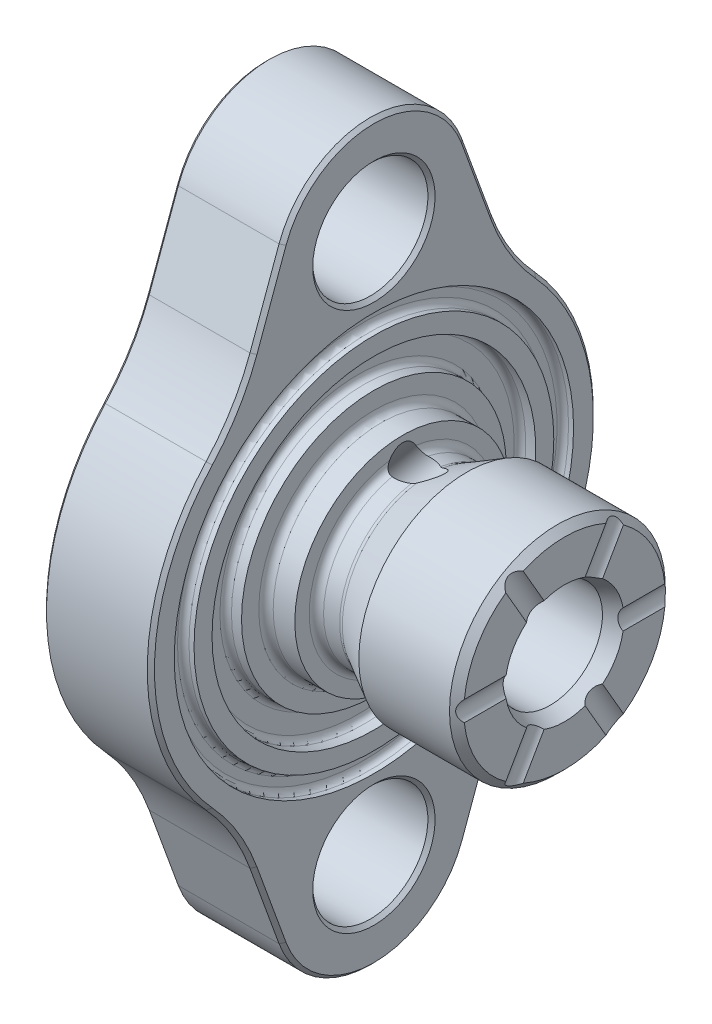
from build123d import *

# Parameters (mm, degrees)
SKETCH2_OUTSIDE_W  = 137.836
SKETCH2_OUTSIDE_H  = 137.836
CUT_EXTRUDE1_DEPTH = 86.057333605
SKETCH3_R          = 8
CUT_EXTRUDE2_DEPTH = 73.692846966
CHAMFER2_SIZE      = 1
CUT_EXTRUDE4_DEPTH = 73.692846966
CIRPATTERN1_COUNT  = 6
CIRPATTERN2_COUNT  = 2
SKETCH13_W         = 0.307692308
SKETCH13_H         = 1.153846154
SKETCH13_W_2       = 0.307692307
EXTRUDE1_DEPTH     = 0.1
CHAMFER3_SIZE      = 0.5


with BuildPart() as part:
    # Sketch1 → Revolve1 (revolve)
    with BuildSketch(Plane.XY, mode=Mode.PRIVATE) as revolve1_sk:
        with BuildLine():
            Line((0, 0), (0, 52.5))
            Line((0, 52.5), (15, 52.5))
            Line((15, 52.5), (15, 27.75))
            Line((15, 27.75), (14.3, 27.75))
            ThreePointArc((14.3, 27.75), (13.734314575, 27.515685425), (13.5, 26.95))
            Line((13.5, 26.95), (13.5, 25.8))
            ThreePointArc((13.5, 25.8), (13.734314575, 25.234314575), (14.3, 25))
            Line((14.3, 25), (15, 25))
            Line((15, 25), (15, 22.5))
            Line((15, 22.5), (13.6, 22.5))
            ThreePointArc((13.6, 22.5), (13.034314575, 22.265685425), (12.8, 21.7))
            Line((12.8, 21.7), (12.8, 19.2))
            ThreePointArc((12.8, 19.2), (13.034314575, 18.634314575), (13.6, 18.4))
            Line((13.6, 18.4), (15, 18.4))
            Line((15, 18.4), (15, 15.9975))
            ThreePointArc((15, 15.9975), (15.292893219, 15.290393219), (16, 14.9975))
            Line((16, 14.9975), (19, 14.9975))
            Line((19, 14.9975), (19, 13))
            ThreePointArc((19, 13), (19.292893219, 12.292893219), (20, 12))
            Line((20, 12), (22.241062764, 12))
            ThreePointArc((22.241062764, 12), (22.491732804, 12.031927414), (22.726396351, 12.125670937))
            Line((22.726396351, 12.125670937), (27.9, 14.9975))
            Line((27.9, 14.9975), (41.5, 14.9975))
            Line((41.5, 14.9975), (41.5, 8.25))
            Line((41.5, 8.25), (39.5, 7.265))
            Line((39.5, 7.265), (30, 7.265))
            Line((30, 7.265), (30, 7.5))
            Line((30, 7.5), (28.5, 7.5))
            Line((28.5, 7.5), (27.90815229, 6.515))
            Line((27.90815229, 6.515), (19, 6.515))
            Line((19, 6.515), (19, 6.9))
            Line((19, 6.9), (12.5, 6.9))
            Line((12.5, 6.9), (8.516283143, 0))
            Line((8.516283143, 0), (0, 0))
        make_face()
    revolve(revolve1_sk.sketch.rotate(Axis((0, 0, 0), (1, 0, 0)), 90), axis=Axis((0, 0, 0), (1, 0, 0)))

    # Sketch2 outside → Cut-Extrude1 (cut, through all)
    with BuildSketch(Plane.ZY):
        Rectangle(SKETCH2_OUTSIDE_W, SKETCH2_OUTSIDE_H)
        with BuildLine():
            Line((12.685850381, 42.117271935), (16.72864246, 31.009791985))
            ThreePointArc((16.72864246, 31.009791985), (19.282353353, 25.690256421), (22.827902518, 20.973480079))
            ThreePointArc((22.827902518, 20.973480079), (31, 0), (22.827902518, -20.973480079))
            ThreePointArc((22.827902518, -20.973480079), (19.282353353, -25.690256421), (16.72864246, -31.009791985))
            Line((16.72864246, -31.009791985), (12.685850381, -42.117271935))
            ThreePointArc((12.685850381, -42.117271935), (0, -51), (-12.685850381, -42.117271935))
            Line((-12.685850381, -42.117271935), (-16.72864246, -31.009791985))
            ThreePointArc((-16.72864246, -31.009791985), (-19.282353353, -25.690256421), (-22.827902518, -20.973480079))
            ThreePointArc((-22.827902518, -20.973480079), (-31, 0), (-22.827902518, 20.973480079))
            ThreePointArc((-22.827902518, 20.973480079), (-19.282353353, 25.690256421), (-16.72864246, 31.009791985))
            Line((-16.72864246, 31.009791985), (-12.685850381, 42.117271935))
            ThreePointArc((-12.685850381, 42.117271935), (0, 51), (12.685850381, 42.117271935))
        make_face(mode=Mode.SUBTRACT)
    extrude(amount=-CUT_EXTRUDE1_DEPTH, mode=Mode.SUBTRACT)

    # Sketch3 → Cut-Extrude2 (cut, through all)
    with BuildSketch(Plane.ZY):
        with Locations((0, 37.5)):
            Circle(SKETCH3_R)
    cut_extrude2 = extrude(amount=-CUT_EXTRUDE2_DEPTH, mode=Mode.SUBTRACT)

    # Mirror1: Cut-Extrude2 across plane
    add(cut_extrude2.mirror(Plane.ZX), mode=Mode.SUBTRACT)

    # Chamfer2
    chamfer2_edges = [part.edges().sort_by_distance(p)[0] for p in [
        (41.5, 0, -14.9975),
    ]]
    chamfer(chamfer2_edges, length=CHAMFER2_SIZE)

    # Sketch8 → Cut-Extrude4 (cut, through all)
    with BuildSketch(Plane.XY):
        with BuildLine():
            Line((45.418346774, -1.4), (41.5, -1.4))
            ThreePointArc((41.5, -1.4), (40.928285686, 0), (41.5, 1.4))
            Line((41.5, 1.4), (45.418346774, 1.4))
            Line((45.418346774, 1.4), (45.418346774, -1.4))
        make_face()
    cut_extrude4 = extrude(amount=-CUT_EXTRUDE4_DEPTH, mode=Mode.SUBTRACT)

    # CirPattern1: Cut-Extrude4 ×6 about axis
    cirpattern1_axis = Axis((30, 0, 0), (1, 0, 0))
    for i in range(1, CIRPATTERN1_COUNT):
        add(cut_extrude4.rotate(cirpattern1_axis, i * 360 / CIRPATTERN1_COUNT), mode=Mode.SUBTRACT)

    # Sketch14 → Cut-Revolve1 (revolve, cut)
    with BuildSketch(Plane.XY, mode=Mode.PRIVATE) as cut_revolve1_sk:
        Polygon((25.804414216, 14.432245132), (15.582644358, 2.25041418), (12.319126134, 2.25041418), (23.889303109, 16.039214156), align=None)
    cut_revolve1 = revolve(cut_revolve1_sk.sketch.rotate(Axis((23.889303109, 16.039214156, 0), (-0.6427876096865435, -0.7660444431189747, 0)), 133.130301737), axis=Axis((23.889303109, 16.039214156, 0), (-0.6427876096865435, -0.7660444431189747, 0)), mode=Mode.SUBTRACT)

    # CirPattern2: Cut-Revolve1 ×2 about axis
    cirpattern2_axis = Axis((30, 0, 0), (1, 0, 0))
    for i in range(1, CIRPATTERN2_COUNT):
        add(cut_revolve1.rotate(cirpattern2_axis, i * 360 / CIRPATTERN2_COUNT), mode=Mode.SUBTRACT)

    # Sketch13 → Extrude1 (cut)
    # profile 1 of 21: a face of its own
    with BuildSketch(Plane.ZY):
        with BuildLine():
            Line((10.307692308, 15.000112869), (10.307692308, 15.269343639))
            add(Edge.make_bspline(
                [(10.307692308, 15.269343639), (10.33789158, 15.262049738), (10.396928686, 15.247790759), (10.481277767, 15.218049982), (10.561097928, 15.18565062), (10.634894563, 15.146745673), (10.704150765, 15.104309598), (10.767295729, 15.055690123), (10.825935414, 15.003130361), (10.877975332, 14.94499469), (10.925099099, 14.884027265), (10.96527772, 14.81936902), (10.99984128, 14.752320825), (11.028315764, 14.68241814), (11.049766213, 14.60945285), (11.065329189, 14.534084601), (11.075435859, 14.456115887), (11.076422227, 14.403189381), (11.076923077, 14.376314793)],
                knots=[0, 0, 0, 0, 1.162005537, 2.271625781, 3.343758855, 4.383309926, 5.390229558, 6.379919256, 7.361854164, 8.333198761, 9.295911338, 10.242430842, 11.177959212, 12.116337295, 13.062827104, 14.020064771, 14.994644689, 16, 16, 16, 16], degree=3))
            add(Edge.make_bspline(
                [(11.076923077, 14.376314793), (11.07574088, 14.337158156), (11.073402272, 14.259699004), (11.052047041, 14.145902107), (11.01825407, 14.036164833), (10.971562304, 13.931688335), (10.913973178, 13.834643964), (10.845431975, 13.748298661), (10.767261146, 13.673822795), (10.680918948, 13.6113419), (10.588642797, 13.562420472), (10.493671233, 13.526346438), (10.396229544, 13.504384997), (10.33043759, 13.501538805), (10.297475962, 13.500112869)],
                knots=[0, 0, 0, 0, 1.083050992, 2.142477498, 3.193116406, 4.255571735, 5.30263384, 6.308962982, 7.297363603, 8.282367274, 9.249857812, 10.179914175, 11.08814088, 12, 12, 12, 12], degree=3))
            add(Edge.make_bspline(
                [(10.297475962, 13.500112869), (10.265755852, 13.501110233), (10.203684519, 13.503061919), (10.113066093, 13.519633667), (10.027659007, 13.547521892), (9.947103725, 13.586153117), (9.871911006, 13.63616016), (9.801911671, 13.696736758), (9.736795249, 13.768310468), (9.699492844, 13.822549558), (9.680288462, 13.850473446)],
                knots=[0, 0, 0, 0, 1.024540389, 2.004866551, 2.965041327, 3.920577974, 4.882998113, 5.874504559, 6.905732034, 8, 8, 8, 8], degree=3))
            add(Edge.make_bspline(
                [(9.680288462, 13.850473446), (9.6648786, 13.818560514), (9.634347208, 13.755331765), (9.574470844, 13.669145596), (9.505336832, 13.590907417), (9.451385987, 13.547275658), (9.424278846, 13.525353254)],
                knots=[0, 0, 0, 0, 1.015518401, 2.012035669, 3.001164323, 4, 4, 4, 4], degree=3))
            add(Edge.make_bspline(
                [(9.424278846, 13.525353254), (9.404517165, 13.510911942), (9.365317415, 13.482265803), (9.302255422, 13.447006906), (9.238703223, 13.414654491), (9.172162029, 13.39084405), (9.10476926, 13.370296584), (9.035081767, 13.356777035), (8.963761641, 13.348098025), (8.915490179, 13.346879315), (8.891225962, 13.346266716)],
                knots=[0, 0, 0, 0, 1.02516404, 2.033540309, 3.025129118, 4.011046665, 4.991655828, 5.976607087, 6.982917762, 8, 8, 8, 8], degree=3))
            add(Edge.make_bspline(
                [(8.891225962, 13.346266716), (8.8492193, 13.347808257), (8.76540366, 13.350884085), (8.641543127, 13.378265345), (8.520676779, 13.420958553), (8.404595461, 13.480526441), (8.296212681, 13.554227566), (8.199679513, 13.642395857), (8.1161433, 13.742887957), (8.046571888, 13.855046166), (7.99091776, 13.976507324), (7.952299868, 14.106432162), (7.927145399, 14.242931418), (7.924448187, 14.336537782), (7.923076923, 14.384127293)],
                knots=[0, 0, 0, 0, 0.95570045, 1.906903359, 2.87519758, 3.868912786, 4.869932978, 5.851730567, 6.836639976, 7.83677598, 8.849487602, 9.869908895, 10.917060885, 12, 12, 12, 12], degree=3))
            add(Edge.make_bspline(
                [(7.923076923, 14.384127293), (7.923821106, 14.416200978), (7.925285409, 14.479311297), (7.935295639, 14.572091439), (7.953578501, 14.660652895), (7.978181334, 14.745115408), (8.009374256, 14.82555401), (8.048218854, 14.901723243), (8.093914427, 14.974091723), (8.14700036, 15.041976539), (8.206384365, 15.105369597), (8.273120659, 15.162586217), (8.345975577, 15.214580326), (8.425795339, 15.25995973), (8.511548417, 15.300791404), (8.604332844, 15.334375081), (8.703319149, 15.36393414), (8.772300069, 15.377677109), (8.807692308, 15.384728254)],
                knots=[0, 0, 0, 0, 1.048658725, 2.063410685, 3.046034179, 4.001477787, 4.936774919, 5.862367409, 6.792675028, 7.730719943, 8.675894397, 9.627829632, 10.600096036, 11.597688215, 12.626045268, 13.701542398, 14.82072376, 16, 16, 16, 16], degree=3))
            Line((8.807692308, 15.384728254), (8.807692308, 15.115497485))
            add(Edge.make_bspline(
                [(8.807692308, 15.115497485), (8.784593153, 15.108483235), (8.739663292, 15.09483991), (8.675000173, 15.071616226), (8.615721842, 15.045157707), (8.561393451, 15.0167738), (8.511479963, 14.986963703), (8.467301219, 14.953608053), (8.42691676, 14.919177357), (8.404164235, 14.893223626), (8.393028846, 14.880521523)],
                knots=[0, 0, 0, 0, 1.198163088, 2.33053128, 3.407730985, 4.417276592, 5.372219308, 6.28897303, 7.162600585, 8, 8, 8, 8], degree=3))
            add(Edge.make_bspline(
                [(8.393028846, 14.880521523), (8.380078846, 14.863724458), (8.354218818, 14.830182175), (8.321217423, 14.775523691), (8.292622258, 14.718039503), (8.27077909, 14.656484068), (8.252283952, 14.592185694), (8.24018065, 14.524105095), (8.231876503, 14.452842909), (8.231143705, 14.404184826), (8.230769231, 14.3793196)],
                knots=[0, 0, 0, 0, 0.946170439, 1.889420265, 2.845303464, 3.807233317, 4.801018734, 5.828864929, 6.890507805, 8, 8, 8, 8], degree=3))
            add(Edge.make_bspline(
                [(8.230769231, 14.3793196), (8.231296291, 14.351244789), (8.232326912, 14.29634692), (8.24183237, 14.216248065), (8.25561558, 14.14002271), (8.277175201, 14.068448737), (8.303039527, 14.000552199), (8.336900678, 13.937848742), (8.375141373, 13.878494963), (8.419622657, 13.824229653), (8.467702109, 13.775306823), (8.518710124, 13.733032092), (8.57106512, 13.69641734), (8.625988434, 13.666985191), (8.682941311, 13.643702978), (8.742136929, 13.627862988), (8.803076821, 13.616846671), (8.844501736, 13.615949674), (8.865384615, 13.615497485)],
                knots=[0, 0, 0, 0, 1.216990249, 2.379719373, 3.493992396, 4.571561497, 5.616923107, 6.638958652, 7.655775068, 8.674704564, 9.676001865, 10.625896028, 11.54399481, 12.441854662, 13.322657739, 14.20572845, 15.095482574, 16, 16, 16, 16], degree=3))
            add(Edge.make_bspline(
                [(8.865384615, 13.615497485), (8.893337223, 13.616809149), (8.94910335, 13.619425949), (9.031146512, 13.639405081), (9.110196997, 13.672265604), (9.184894729, 13.718275944), (9.254158865, 13.774257612), (9.315717703, 13.839668706), (9.367023445, 13.914669681), (9.402340393, 13.984143404), (9.425877654, 14.045829407), (9.442381541, 14.098514155), (9.455574456, 14.157548512), (9.468335977, 14.222223782), (9.479034427, 14.292812735), (9.487994798, 14.369378965), (9.49515324, 14.451953276), (9.498351754, 14.509117018), (9.5, 14.538574408)],
                knots=[0, 0, 0, 0, 1.070481957, 2.135637345, 3.216366529, 4.339485895, 5.485746587, 6.620975969, 7.768829582, 8.956804399, 9.598399438, 10.297751078, 11.070570279, 11.915248466, 12.824061284, 13.805856426, 14.869322739, 16, 16, 16, 16], degree=3))
            Line((9.5, 14.538574408), (9.807692308, 14.538574408))
            add(Edge.make_bspline(
                [(9.807692308, 14.538574408), (9.808324886, 14.501460149), (9.80956395, 14.428762433), (9.824446445, 14.322552874), (9.845265096, 14.220869774), (9.87641744, 14.126034166), (9.913809143, 14.03987673), (9.955971019, 13.964717859), (10.003738533, 13.90233879), (10.056484782, 13.852583673), (10.113716361, 13.816065184), (10.172742216, 13.788654442), (10.234935682, 13.772585153), (10.277355669, 13.770427948), (10.298677885, 13.769343639)],
                knots=[0, 0, 0, 0, 1.321708579, 2.588902423, 3.815526512, 5.016621128, 6.138757764, 7.158873101, 8.079948563, 8.928590313, 9.728601868, 10.489025425, 11.240515403, 12, 12, 12, 12], degree=3))
            add(Edge.make_bspline(
                [(10.298677885, 13.769343639), (10.314344561, 13.769698807), (10.345512671, 13.770405397), (10.391047891, 13.779317956), (10.435193622, 13.792707726), (10.477749556, 13.8111276), (10.518468679, 13.83573734), (10.557400946, 13.865277227), (10.59519882, 13.899761518), (10.630054006, 13.940091459), (10.662931371, 13.983752921), (10.69135263, 14.031156731), (10.715442471, 14.081257341), (10.735345814, 14.134100821), (10.750308307, 14.189898861), (10.761054045, 14.248378243), (10.767771832, 14.309653547), (10.768739073, 14.351457868), (10.769230769, 14.372709023)],
                knots=[0, 0, 0, 0, 0.884317272, 1.759307272, 2.611736065, 3.488921043, 4.37244062, 5.294096728, 6.247679003, 7.258495569, 8.302441962, 9.333537773, 10.376747089, 11.440883505, 12.520330301, 13.637364711, 14.798958396, 16, 16, 16, 16], degree=3))
            add(Edge.make_bspline(
                [(10.769230769, 14.372709023), (10.768040487, 14.406868725), (10.765715588, 14.473590566), (10.745280774, 14.569759054), (10.712903918, 14.659068392), (10.673808961, 14.727104092), (10.635349996, 14.777429301), (10.602263749, 14.814080705), (10.564750721, 14.849416413), (10.521781972, 14.88204982), (10.474835025, 14.913936388), (10.423651312, 14.944771648), (10.367501106, 14.973565172), (10.328014664, 14.991092261), (10.307692308, 15.000112869)],
                knots=[0, 0, 0, 0, 1.4727372, 2.876598283, 4.222346151, 5.558423782, 6.24313385, 6.953189256, 7.68715613, 8.463578749, 9.278833271, 10.135787152, 11.040551781, 12, 12, 12, 12], degree=3))
        make_face()
    # profile 2 of 21: a face of its own
    with BuildSketch(Plane.ZY):
        Polygon((11, 12.439415754), (11, 11.884728254), (8, 11.884728254), (8, 12.153959023), (10.692307692, 12.153959023), (10.692307692, 12.615497485), align=None)
    # profile 3 of 21: a face of its own
    with BuildSketch(Plane.ZY):
        Polygon((11, 10.131723446), (11, 9.577035946), (8, 9.577035946), (8, 9.846266716), (10.692307692, 9.846266716), (10.692307692, 10.307805177), align=None)
    # profile 4 of 21: a face of its own
    with BuildSketch(Plane.ZY):
        with BuildLine():
            Line((11, 6.577035946), (10.692307692, 6.577035946))
            Line((10.692307692, 6.577035946), (10.692307692, 7.596867677))
            Line((10.692307692, 7.596867677), (9.903245192, 7.759127293))
            add(Edge.make_bspline(
                [(9.903245192, 7.759127293), (9.912013997, 7.727365114), (9.929002168, 7.665830918), (9.947864257, 7.57500818), (9.959234638, 7.488786291), (9.96078719, 7.432835974), (9.961538462, 7.405761908)],
                knots=[0, 0, 0, 0, 1.100273476, 2.13160584, 3.095893838, 4, 4, 4, 4], degree=3))
            add(Edge.make_bspline(
                [(9.961538462, 7.405761908), (9.960813184, 7.372261675), (9.959387107, 7.306391848), (9.945699647, 7.210013965), (9.924141356, 7.118020308), (9.894073597, 7.030568052), (9.855376794, 6.947468834), (9.807664445, 6.869186719), (9.751266572, 6.795278054), (9.686727319, 6.726719881), (9.61560935, 6.664620376), (9.539393104, 6.609804949), (9.458009254, 6.564216204), (9.371817674, 6.52670966), (9.280962984, 6.496951838), (9.184772679, 6.477091336), (9.084100359, 6.463881421), (9.015268218, 6.462404477), (8.980168269, 6.461651331)],
                knots=[0, 0, 0, 0, 1.052772836, 2.070014431, 3.053871312, 4.019926262, 4.972333346, 5.930471369, 6.896690565, 7.89035727, 8.885779078, 9.861050232, 10.836829716, 11.812751485, 12.812646763, 13.836748493, 14.896881366, 16, 16, 16, 16], degree=3))
            add(Edge.make_bspline(
                [(8.980168269, 6.461651331), (8.95572062, 6.462221319), (8.90715571, 6.463353591), (8.835032579, 6.469113506), (8.764434116, 6.480197075), (8.695361378, 6.49509915), (8.627906708, 6.514364289), (8.562094644, 6.537939406), (8.497722538, 6.565728657), (8.434786175, 6.59710338), (8.375225782, 6.63339812), (8.318121955, 6.671630393), (8.265576235, 6.713981228), (8.215670353, 6.758400207), (8.170364191, 6.806663464), (8.127718904, 6.857272984), (8.089586913, 6.911416445), (8.054514091, 6.968124479), (8.023111247, 7.027361327), (7.996915667, 7.089727637), (7.973955014, 7.153854306), (7.95528329, 7.220312888), (7.94079673, 7.288974634), (7.93093158, 7.360075984), (7.923753825, 7.433260165), (7.923304096, 7.482867216), (7.923076923, 7.507925369)],
                knots=[0, 0, 0, 0, 1.05623316, 2.098192244, 3.122504159, 4.140841222, 5.148757784, 6.150489607, 7.158294732, 8.176043417, 9.185147859, 10.169157858, 11.142149047, 12.097904048, 13.0527185, 13.998867679, 14.954465986, 15.910220987, 16.877849176, 17.847023716, 18.829548819, 19.818454515, 20.826519638, 21.858115382, 22.918063636, 24, 24, 24, 24], degree=3))
            add(Edge.make_bspline(
                [(7.923076923, 7.507925369), (7.923669122, 7.537817488), (7.924834203, 7.596626699), (7.937020736, 7.682787707), (7.954478222, 7.765684035), (7.980728043, 7.844659634), (8.013667747, 7.92038082), (8.055034258, 7.991839602), (8.102566261, 8.060440533), (8.157903772, 8.124319121), (8.218955449, 8.183485862), (8.28449812, 8.23726329), (8.354792393, 8.284425772), (8.429239827, 8.325165775), (8.507968523, 8.359866215), (8.591214063, 8.387139556), (8.678557676, 8.409148656), (8.738689153, 8.418460286), (8.769230769, 8.423189793)],
                knots=[0, 0, 0, 0, 1.046825758, 2.059506013, 3.044032586, 4.011925612, 4.970610144, 5.93275819, 6.900651216, 7.891265644, 8.889116719, 9.876966323, 10.858259055, 11.851035124, 12.847502422, 13.86866322, 14.9174643, 16, 16, 16, 16], degree=3))
            Line((8.769230769, 8.423189793), (8.769230769, 8.153959023))
            add(Edge.make_bspline(
                [(8.769230769, 8.153959023), (8.740619652, 8.147338715), (8.685627496, 8.134614114), (8.608408384, 8.106610848), (8.53933665, 8.072582767), (8.478347086, 8.031199182), (8.424883236, 7.982831814), (8.376827964, 7.928035742), (8.334048616, 7.866030324), (8.298160408, 7.797155086), (8.267598198, 7.724449041), (8.247236672, 7.648365289), (8.232922387, 7.570960929), (8.231489347, 7.518608125), (8.230769231, 7.492300369)],
                knots=[0, 0, 0, 0, 1.136389429, 2.184203582, 3.172920998, 4.111012962, 5.028380909, 5.957351669, 6.927793475, 7.937618031, 8.960409703, 9.974842029, 10.982339866, 12, 12, 12, 12], degree=3))
            add(Edge.make_bspline(
                [(8.230769231, 7.492300369), (8.231472755, 7.466621703), (8.232857999, 7.416060198), (8.243520009, 7.341650438), (8.259940785, 7.269810832), (8.284514946, 7.20125024), (8.314381848, 7.13476892), (8.352709056, 7.072048546), (8.396817643, 7.011274651), (8.447351897, 6.954336251), (8.503040207, 6.902188152), (8.562592258, 6.856111476), (8.626120984, 6.817731265), (8.692526544, 6.785387743), (8.762536735, 6.760827772), (8.835823457, 6.743306931), (8.912567726, 6.733018595), (8.964912848, 6.731603298), (8.991586538, 6.7308821)],
                knots=[0, 0, 0, 0, 1.027316725, 2.022795036, 3.002884548, 3.971462791, 4.93288096, 5.914575861, 6.907176829, 7.935150275, 8.956128384, 9.956726525, 10.942570165, 11.921478529, 12.907843606, 13.90538589, 14.932640048, 16, 16, 16, 16], degree=3))
            add(Edge.make_bspline(
                [(8.991586538, 6.7308821), (9.015665969, 6.731355603), (9.062825038, 6.732282948), (9.131515754, 6.742588032), (9.196982005, 6.757023856), (9.25863835, 6.779188221), (9.317387656, 6.806574176), (9.371972473, 6.841318535), (9.42379518, 6.881034915), (9.470750501, 6.927553782), (9.514380581, 6.978280629), (9.551519507, 7.034392998), (9.582777841, 7.094611008), (9.609749431, 7.158237701), (9.629121772, 7.226778674), (9.643665597, 7.298878748), (9.652078786, 7.375315897), (9.653246116, 7.427576491), (9.653846154, 7.454439793)],
                knots=[0, 0, 0, 0, 1.045726679, 2.048034203, 3.01323695, 3.95502507, 4.889743367, 5.8246644, 6.761650845, 7.722168973, 8.692072792, 9.66525385, 10.638902184, 11.638179751, 12.663148338, 13.728659964, 14.832472288, 16, 16, 16, 16], degree=3))
            add(Edge.make_bspline(
                [(9.653846154, 7.454439793), (9.653365403, 7.477895098), (9.652381232, 7.525911749), (9.644636009, 7.599737269), (9.632720729, 7.676979212), (9.615547008, 7.757937456), (9.594044327, 7.842389826), (9.567190174, 7.930476766), (9.536257576, 8.022200406), (9.512265199, 8.083936983), (9.5, 8.115497485)],
                knots=[0, 0, 0, 0, 0.824638674, 1.688163388, 2.607705698, 3.571998603, 4.597075385, 5.671199175, 6.809488238, 8, 8, 8, 8], degree=3))
            Line((9.5, 8.115497485), (11, 7.807805177))
            Line((11, 7.807805177), (11, 6.577035946))
        make_face()
    # profile 5 of 21: a face of its own
    with BuildSketch(Plane.ZY):
        with BuildLine():
            Line((10.076923077, 4.615497485), (10.076923077, 4.884728254))
            add(Edge.make_bspline(
                [(10.076923077, 4.884728254), (10.112641157, 4.88297385), (10.182790515, 4.879528248), (10.285065658, 4.863385488), (10.382835931, 4.840308603), (10.475263133, 4.807603273), (10.563451385, 4.767215049), (10.64622965, 4.717768175), (10.724419491, 4.660316778), (10.796540515, 4.594966256), (10.862468149, 4.524054915), (10.920002504, 4.448007627), (10.968057234, 4.367606013), (11.008448343, 4.283547442), (11.038729962, 4.194859752), (11.061208295, 4.102390699), (11.074730156, 4.005722331), (11.076183786, 3.939859529), (11.076923077, 3.906362869)],
                knots=[0, 0, 0, 0, 1.100776268, 2.161895295, 3.184016182, 4.190939212, 5.176500551, 6.166955529, 7.155448256, 8.160289653, 9.16017456, 10.133824356, 11.091467644, 12.04088621, 13.000931625, 13.972173743, 14.968683325, 16, 16, 16, 16], degree=3))
            add(Edge.make_bspline(
                [(11.076923077, 3.906362869), (11.076152971, 3.873467377), (11.074639742, 3.808828911), (11.061644574, 3.714490041), (11.041291209, 3.624680931), (11.012735138, 3.539577132), (10.974348486, 3.459857648), (10.92823631, 3.384923609), (10.874905026, 3.313882915), (10.812116043, 3.249934243), (10.745085428, 3.191213032), (10.673524368, 3.140553956), (10.599613551, 3.097171245), (10.522789379, 3.061010376), (10.442328497, 3.034390829), (10.359402323, 3.014180936), (10.273152485, 3.002757439), (10.214775438, 3.001004218), (10.185096154, 3.000112869)],
                knots=[0, 0, 0, 0, 1.111607364, 2.184268762, 3.212621178, 4.221274766, 5.211760367, 6.196651075, 7.1921475, 8.207485113, 9.220403448, 10.201281604, 11.166441695, 12.114753415, 13.065576456, 14.026450734, 14.996634279, 16, 16, 16, 16], degree=3))
            add(Edge.make_bspline(
                [(10.185096154, 3.000112869), (10.14331231, 3.001562283), (10.06047787, 3.004435676), (9.938563362, 3.029114554), (9.820537456, 3.06750919), (9.725178651, 3.113136853), (9.648818523, 3.159885816), (9.585832949, 3.201935906), (9.51803213, 3.251199231), (9.445621794, 3.30834984), (9.368041384, 3.372218751), (9.285335735, 3.443380384), (9.198359965, 3.522343434), (9.138955159, 3.577764996), (9.108173077, 3.606483062)],
                knots=[0, 0, 0, 0, 1.184136889, 2.347493852, 3.513608722, 4.697895552, 5.335178528, 6.052199267, 6.845488095, 7.711597353, 8.668264519, 9.695616787, 10.805926351, 12, 12, 12, 12], degree=3))
            Line((9.108173077, 3.606483062), (8.307692308, 4.357084023))
            Line((8.307692308, 4.357084023), (8.307692308, 2.961651331))
            Line((8.307692308, 2.961651331), (8, 2.961651331))
            Line((8, 2.961651331), (8, 5.000112869))
            Line((8, 5.000112869), (9.241586538, 3.836651331))
            add(Edge.make_bspline(
                [(9.241586538, 3.836651331), (9.271154903, 3.808322565), (9.327949679, 3.753908804), (9.410893435, 3.676978695), (9.487751152, 3.607771944), (9.558863403, 3.546242643), (9.62382705, 3.492340166), (9.683151197, 3.446236975), (9.736326742, 3.407729305), (9.798795148, 3.366919199), (9.875155888, 3.328004055), (9.968003312, 3.293801625), (10.06379382, 3.273095939), (10.128506606, 3.270599413), (10.161057692, 3.269343639)],
                knots=[0, 0, 0, 0, 1.329530082, 2.553755191, 3.672934919, 4.687409497, 5.60679272, 6.413407421, 7.126401618, 7.737995624, 8.834647426, 9.90044882, 10.943907757, 12, 12, 12, 12], degree=3))
            add(Edge.make_bspline(
                [(10.161057692, 3.269343639), (10.181529724, 3.269882963), (10.221876168, 3.270945868), (10.280991506, 3.280504208), (10.338236247, 3.294547305), (10.3929026, 3.316192057), (10.446065747, 3.342197429), (10.496109363, 3.37542121), (10.544739314, 3.413387266), (10.59028812, 3.45742603), (10.6320179, 3.505772409), (10.66898061, 3.556854854), (10.699871483, 3.610897367), (10.725194425, 3.667674731), (10.745059052, 3.727027959), (10.758823545, 3.789072035), (10.767465675, 3.853635475), (10.768634965, 3.897721329), (10.769230769, 3.920184985)],
                knots=[0, 0, 0, 0, 0.991504627, 1.954065223, 2.895985987, 3.842598665, 4.797835564, 5.759220273, 6.74786863, 7.784730864, 8.824135544, 9.839918996, 10.835834653, 11.835434876, 12.84861661, 13.863796685, 14.911511676, 16, 16, 16, 16], degree=3))
            add(Edge.make_bspline(
                [(10.769230769, 3.920184985), (10.76861807, 3.943645803), (10.767414829, 3.989718975), (10.758992773, 4.057362384), (10.744477339, 4.121898427), (10.724576987, 4.183457746), (10.699522285, 4.242099652), (10.667713455, 4.297293905), (10.630392431, 4.34954441), (10.5878485, 4.398755202), (10.540258071, 4.443972199), (10.487860271, 4.484535519), (10.430314258, 4.519131743), (10.368919822, 4.549799738), (10.302044563, 4.573265294), (10.231309021, 4.593323425), (10.155708214, 4.607894174), (10.10362097, 4.612920953), (10.076923077, 4.615497485)],
                knots=[0, 0, 0, 0, 1.031212865, 2.025131798, 2.990757446, 3.934781266, 4.865570067, 5.788494791, 6.729227313, 7.684356718, 8.643577152, 9.610526866, 10.590658432, 11.59095419, 12.621640561, 13.700587263, 14.82141059, 16, 16, 16, 16], degree=3))
        make_face()
    # profile 6 of 21: a face of its own
    with BuildSketch(Plane.ZY):
        with BuildLine():
            add(Edge.make_bspline(
                [(9.498798077, 2.692420562), (9.546881552, 2.692139403), (9.640284396, 2.691593249), (9.776385517, 2.68551746), (9.904065766, 2.67542431), (10.023331249, 2.661592274), (10.134212768, 2.644759726), (10.236413966, 2.622289285), (10.33040799, 2.596735537), (10.41650092, 2.567118876), (10.495854114, 2.533701731), (10.569929763, 2.497326123), (10.638633822, 2.456568299), (10.70299841, 2.413688046), (10.762305186, 2.367118407), (10.816441839, 2.317350576), (10.865441057, 2.263890876), (10.909886014, 2.207796618), (10.948603237, 2.148713303), (10.983490028, 2.088462272), (11.012123751, 2.025980347), (11.035651483, 1.961837382), (11.054503657, 1.896219912), (11.067558752, 1.828856812), (11.075740787, 1.759731806), (11.076525241, 1.713076814), (11.076923077, 1.689415754)],
                knots=[0, 0, 0, 0, 1.646377244, 3.198111528, 4.663803227, 6.031090796, 7.308794487, 8.502186765, 9.612154809, 10.642545331, 11.617106989, 12.558866172, 13.465886467, 14.35053239, 15.20542558, 16.045215227, 16.865619885, 17.686225247, 18.492864914, 19.282407821, 20.068097601, 20.842842034, 21.620163247, 22.403093475, 23.190129512, 24, 24, 24, 24], degree=3))
            add(Edge.make_bspline(
                [(11.076923077, 1.689415754), (11.07650495, 1.665556773), (11.075673426, 1.618108765), (11.067681475, 1.547959872), (11.054420513, 1.479431573), (11.035631106, 1.412816026), (11.012320526, 1.347566037), (10.983102997, 1.284191974), (10.949092539, 1.222300189), (10.909129216, 1.162874229), (10.864572979, 1.105261701), (10.814204977, 1.050877733), (10.758533789, 0.999717374), (10.698155049, 0.95113854), (10.63191069, 0.906519457), (10.560952882, 0.864027944), (10.484040712, 0.82599477), (10.402457454, 0.789365049), (10.313945746, 0.757747631), (10.219004523, 0.729233707), (10.116512363, 0.706194591), (10.00700701, 0.687003786), (9.89008631, 0.672136732), (9.766000897, 0.661308753), (9.634669133, 0.655588966), (9.544876691, 0.654511794), (9.498798077, 0.653959023)],
                knots=[0, 0, 0, 0, 0.810914788, 1.612654377, 2.396697861, 3.181598691, 3.963628158, 4.749916497, 5.551656086, 6.361998678, 7.18212741, 8.025565596, 8.878627764, 9.750805457, 10.657531673, 11.591944965, 12.560506719, 13.57287815, 14.630710178, 15.753379473, 16.941251878, 18.199788006, 19.531962791, 20.947069417, 22.433333509, 24, 24, 24, 24], degree=3))
            add(Edge.make_bspline(
                [(9.498798077, 0.653959023), (9.452920613, 0.654518215), (9.363530246, 0.655607776), (9.23278704, 0.661237131), (9.109368472, 0.672378034), (8.992930991, 0.686157573), (8.884165925, 0.705786337), (8.782039049, 0.728100782), (8.687431701, 0.755835241), (8.599386797, 0.787021712), (8.518203244, 0.822856605), (8.441955943, 0.861225921), (8.371056034, 0.903456613), (8.304812638, 0.948341794), (8.243910257, 0.996507713), (8.188198373, 1.047884706), (8.137713732, 1.10251188), (8.092548717, 1.160254663), (8.053050595, 1.220615478), (8.017745626, 1.282300675), (7.989097834, 1.346541436), (7.964909947, 1.411910061), (7.946077315, 1.479023346), (7.933182738, 1.547815463), (7.924114216, 1.618061118), (7.923423885, 1.665548518), (7.923076923, 1.689415754)],
                knots=[0, 0, 0, 0, 1.56130642, 3.042141888, 4.451772327, 5.777565838, 7.030558081, 8.211376819, 9.333164717, 10.383253789, 11.387583522, 12.350962576, 13.286244149, 14.193812918, 15.072134482, 15.925989337, 16.770211267, 17.600669898, 18.417446232, 19.22325363, 20.01647746, 20.807971184, 21.593601364, 22.38506573, 23.188331689, 24, 24, 24, 24], degree=3))
            add(Edge.make_bspline(
                [(7.923076923, 1.689415754), (7.923478587, 1.713075853), (7.92427059, 1.759728949), (7.932397328, 1.828867839), (7.9456493, 1.896125881), (7.963645411, 1.961637527), (7.986517401, 2.025536848), (8.015609725, 2.087197888), (8.049352296, 2.147434977), (8.087740784, 2.205973251), (8.131732992, 2.261697006), (8.180387068, 2.314925506), (8.234923354, 2.364314752), (8.294468914, 2.410300726), (8.358518504, 2.453938917), (8.42770306, 2.494297344), (8.502472754, 2.530602), (8.582264003, 2.564768051), (8.668989672, 2.594885361), (8.763485022, 2.621287904), (8.866272778, 2.643298117), (8.977047794, 2.660998844), (9.095892981, 2.675591313), (9.223017589, 2.685469667), (9.358311937, 2.691598088), (9.45111482, 2.692141401), (9.498798077, 2.692420562)],
                knots=[0, 0, 0, 0, 0.810940842, 1.599017053, 2.38298203, 3.159479784, 3.926441347, 4.70693857, 5.494146311, 6.292334103, 7.104379492, 7.925868426, 8.762126819, 9.623561095, 10.503686106, 11.41783325, 12.366995289, 13.351843594, 14.392337808, 15.512229747, 16.713911458, 17.994391108, 19.357476964, 20.818259213, 22.365182633, 24, 24, 24, 24], degree=3))
        make_face()
        with BuildLine():
            add(Edge.make_bspline(
                [(9.5, 2.423189793), (9.459929687, 2.423087409), (9.382161077, 2.422888704), (9.269152568, 2.417697674), (9.163749428, 2.410626048), (9.065817827, 2.401504933), (8.975689238, 2.387959557), (8.892743819, 2.372782284), (8.817420395, 2.35431258), (8.749202531, 2.332459419), (8.686931016, 2.307569749), (8.628990206, 2.280389854), (8.574677616, 2.251207126), (8.524544883, 2.218490193), (8.478092971, 2.182981147), (8.43545537, 2.144621678), (8.396818119, 2.103479249), (8.350971273, 2.046524642), (8.303034266, 1.97170424), (8.26180478, 1.87694981), (8.235726998, 1.779542907), (8.232419904, 1.71341021), (8.230769231, 1.680401331)],
                knots=[0, 0, 0, 0, 1.459116078, 2.831857795, 4.118796693, 5.306371758, 6.412361096, 7.436813035, 8.376339383, 9.234574298, 10.043323891, 10.816788787, 11.564361537, 12.286735248, 12.994408768, 13.691741332, 14.372975427, 15.047457468, 16.352811911, 17.594285292, 18.799233213, 20, 20, 20, 20], degree=3))
            add(Edge.make_bspline(
                [(8.230769231, 1.680401331), (8.232138757, 1.64718047), (8.234874982, 1.580807335), (8.2612739, 1.483835511), (8.301104934, 1.38969528), (8.348202796, 1.315919331), (8.39305565, 1.259791436), (8.431296777, 1.219576873), (8.474116092, 1.182666546), (8.520315488, 1.147659053), (8.570777617, 1.115551274), (8.625259825, 1.086354299), (8.683913406, 1.05971143), (8.724858896, 1.044532247), (8.745793269, 1.036771523)],
                knots=[0, 0, 0, 0, 1.353760809, 2.704726607, 4.075137775, 5.516104923, 6.260822281, 7.007110065, 7.778089737, 8.566572457, 9.372053459, 10.217411131, 11.088608312, 12, 12, 12, 12], degree=3))
            add(Edge.make_bspline(
                [(8.745793269, 1.036771523), (8.772561617, 1.027727151), (8.826912844, 1.009363196), (8.911224546, 0.985695961), (8.999684058, 0.967057047), (9.091762729, 0.950288448), (9.188139616, 0.938842972), (9.288516516, 0.92963056), (9.392969112, 0.924204257), (9.463936248, 0.923531614), (9.5, 0.923189793)],
                knots=[0, 0, 0, 0, 0.884706709, 1.796334032, 2.740027952, 3.714592787, 4.726048262, 5.777819803, 6.87074269, 8, 8, 8, 8], degree=3))
            add(Edge.make_bspline(
                [(9.5, 0.923189793), (9.536062977, 0.923566785), (9.606618597, 0.924304353), (9.709841532, 0.929150243), (9.808052396, 0.936937185), (9.901340284, 0.94747664), (9.989539154, 0.961945084), (10.072775216, 0.979320245), (10.151026032, 0.999690627), (10.224493403, 1.023056062), (10.292913268, 1.049388585), (10.356434591, 1.078478127), (10.415394124, 1.10952061), (10.469622631, 1.143243719), (10.519364886, 1.179239719), (10.563623091, 1.218460552), (10.603769069, 1.259349995), (10.649594126, 1.316621875), (10.696318437, 1.391599834), (10.73931766, 1.484896104), (10.764010482, 1.581985228), (10.767491928, 1.647619617), (10.769230769, 1.680401331)],
                knots=[0, 0, 0, 0, 1.313668642, 2.570134578, 3.763346207, 4.902004944, 5.98888779, 7.017888835, 7.998425394, 8.933058446, 9.82474457, 10.667209444, 11.476765193, 12.250262638, 12.991704352, 13.7104269, 14.401925311, 15.076585796, 16.378385137, 17.609787933, 18.806186071, 20, 20, 20, 20], degree=3))
            add(Edge.make_bspline(
                [(10.769230769, 1.680401331), (10.767491773, 1.713583232), (10.764010611, 1.780007483), (10.739382411, 1.878084624), (10.69671877, 1.972045487), (10.649292396, 2.046421906), (10.604580301, 2.103621526), (10.565698494, 2.144012444), (10.522931907, 2.181773747), (10.47667666, 2.217312377), (10.426518642, 2.249997814), (10.372213951, 2.279192485), (10.314267756, 2.306356779), (10.25201041, 2.331299885), (10.183689703, 2.352950524), (10.108746428, 2.372302202), (10.025723535, 2.387470268), (9.935342971, 2.400706564), (9.837290981, 2.41079849), (9.731644838, 2.417679521), (9.618440901, 2.422898096), (9.540271037, 2.423090613), (9.5, 2.423189793)],
                knots=[0, 0, 0, 0, 1.207964612, 2.418129846, 3.655795183, 4.951004962, 5.620895151, 6.296795572, 6.989224116, 7.696855977, 8.419187164, 9.166715907, 9.940135271, 10.748837255, 11.607021648, 12.548275234, 13.5654991, 14.678641405, 15.874140913, 17.15372626, 18.533675393, 20, 20, 20, 20], degree=3))
        make_face(mode=Mode.SUBTRACT)
    # profile 7 of 21: a face of its own
    with BuildSketch(Plane.ZY):
        Polygon((11, 0.192420562), (11, -1.653733284), (7.923076923, -0.076810207), (8.051081731, 0.155761908), (10.692307692, -1.197603477), (10.692307692, 0.192420562), align=None)
    # profile 8 of 21: a face of its own
    with BuildSketch(Plane.ZY):
        with BuildLine():
            Line((11.076923077, -3.307579438), (10.9140625, -3.515512131))
            Line((10.9140625, -3.515512131), (9.701923077, -2.722843861))
            add(Edge.make_bspline(
                [(9.701923077, -2.722843861), (9.710334957, -2.775618384), (9.726743282, -2.878561059), (9.729450092, -2.9827604), (9.730769231, -3.033540977)],
                knots=[0, 0, 0, 0, 1.025318673, 2, 2, 2, 2], degree=3))
            add(Edge.make_bspline(
                [(9.730769231, -3.033540977), (9.729961576, -3.064033222), (9.72837699, -3.123857773), (9.715854493, -3.211761573), (9.696363295, -3.29624791), (9.667836744, -3.377128306), (9.631408145, -3.45450541), (9.587745716, -3.528821679), (9.534598138, -3.598680564), (9.475228135, -3.664981569), (9.409470731, -3.725176226), (9.339698153, -3.778469987), (9.265983113, -3.823235809), (9.188362942, -3.859556313), (9.106957291, -3.887760495), (9.021870314, -3.908321333), (8.933043339, -3.92047527), (8.872633474, -3.922125691), (8.841947115, -3.922964054)],
                knots=[0, 0, 0, 0, 1.044136307, 2.048553127, 3.035567123, 4.010001674, 4.980053131, 5.96154148, 6.956538004, 7.981742224, 9.006487041, 10.005615874, 10.984750588, 11.954802044, 12.935714515, 13.930994945, 14.949008866, 16, 16, 16, 16], degree=3))
            add(Edge.make_bspline(
                [(8.841947115, -3.922964054), (8.799989469, -3.921398458), (8.717475431, -3.918319552), (8.596791933, -3.895906424), (8.482742142, -3.857226373), (8.374877863, -3.805477104), (8.276337412, -3.738336496), (8.187283268, -3.658771184), (8.109659499, -3.566029054), (8.043069301, -3.46230626), (7.990163473, -3.350045984), (7.951049114, -3.232337413), (7.927677291, -3.110186656), (7.924617433, -3.027229485), (7.923076923, -2.985464054)],
                knots=[0, 0, 0, 0, 1.031881447, 2.029301251, 3.006342947, 3.987068354, 4.962916383, 5.929513747, 6.915671209, 7.928552063, 8.953527267, 9.960179832, 10.973036711, 12, 12, 12, 12], degree=3))
            add(Edge.make_bspline(
                [(7.923076923, -2.985464054), (7.92438681, -2.945095445), (7.926981468, -2.8651323), (7.950095177, -2.747504305), (7.987558225, -2.63447843), (8.039171153, -2.526849155), (8.10436106, -2.427139737), (8.182852467, -2.33796287), (8.272910623, -2.259628819), (8.374811795, -2.194782085), (8.483606077, -2.14193182), (8.598081295, -2.104655764), (8.715933588, -2.080549241), (8.796157026, -2.078062127), (8.836538462, -2.076810207)],
                knots=[0, 0, 0, 0, 1.011913813, 2.004424092, 2.994488568, 3.992479987, 4.990471406, 5.973328987, 6.963763268, 7.974390938, 8.994854117, 9.989689954, 10.988086187, 12, 12, 12, 12], degree=3))
            add(Edge.make_bspline(
                [(8.836538462, -2.076810207), (8.867422569, -2.077897449), (8.930453956, -2.0801164), (9.026192904, -2.093358846), (9.12377053, -2.11764711), (9.206489661, -2.14393232), (9.274996089, -2.170015183), (9.329093805, -2.194199813), (9.386222731, -2.221241177), (9.44530193, -2.252937422), (9.508019423, -2.286537998), (9.57205259, -2.325787285), (9.639740121, -2.366744519), (9.684805427, -2.396748744), (9.707932692, -2.412146746)],
                knots=[0, 0, 0, 0, 1.17367173, 2.395347028, 3.66355231, 4.98980831, 5.690886799, 6.447442954, 7.240630024, 8.091733897, 8.994365608, 9.943299771, 10.944512865, 12, 12, 12, 12], degree=3))
            Line((9.707932692, -2.412146746), (11.076923077, -3.307579438))
        make_face()
        with BuildLine():
            add(Edge.make_bspline(
                [(9.423076923, -2.977050592), (9.422401193, -2.954197958), (9.421075416, -2.909361278), (9.413587448, -2.843662345), (9.399399715, -2.781650551), (9.381047827, -2.722617188), (9.356059447, -2.667179105), (9.326069887, -2.61469812), (9.290400933, -2.565716511), (9.24951111, -2.521013918), (9.205126601, -2.480116393), (9.157950787, -2.444113088), (9.108174871, -2.413762125), (9.056227121, -2.388964188), (9.001836066, -2.369698285), (8.945301833, -2.355750998), (8.886231817, -2.347991468), (8.84617547, -2.346700298), (8.825721154, -2.346040977)],
                knots=[0, 0, 0, 0, 1.129054775, 2.21519617, 3.259426851, 4.267013074, 5.263608451, 6.256463875, 7.247987236, 8.249677815, 9.244060445, 10.225610515, 11.175892485, 12.118571871, 13.063688666, 14.021206195, 14.989551517, 16, 16, 16, 16], degree=3))
            add(Edge.make_bspline(
                [(8.825721154, -2.346040977), (8.805450514, -2.346579241), (8.765702807, -2.347634698), (8.707115357, -2.357174089), (8.650786736, -2.371849632), (8.596675747, -2.393330739), (8.545077555, -2.420274328), (8.495625645, -2.453431385), (8.448285883, -2.492240481), (8.40425201, -2.537355285), (8.363863071, -2.586007228), (8.327900685, -2.637459879), (8.297701896, -2.691549641), (8.273827374, -2.748585153), (8.254273571, -2.807767875), (8.240503873, -2.869549291), (8.232721299, -2.933983685), (8.231428461, -2.977630989), (8.230769231, -2.999887131)],
                knots=[0, 0, 0, 0, 0.989642335, 1.94054129, 2.892446913, 3.828371744, 4.778262963, 5.730973156, 6.732161388, 7.763274768, 8.805796303, 9.818398792, 10.825975928, 11.825728216, 12.834635236, 13.867465554, 14.912602056, 16, 16, 16, 16], degree=3))
            add(Edge.make_bspline(
                [(8.230769231, -2.999887131), (8.231428409, -3.022143309), (8.232721146, -3.065790684), (8.240504454, -3.13022456), (8.254271436, -3.192007892), (8.273835111, -3.25118365), (8.297673195, -3.308244869), (8.328089915, -3.362381977), (8.363644418, -3.414325865), (8.404321524, -3.462945891), (8.448037071, -3.508249262), (8.496054274, -3.546149364), (8.544684519, -3.580353928), (8.596881363, -3.606262689), (8.650754162, -3.627983028), (8.707124083, -3.642584528), (8.765700523, -3.652143659), (8.805449743, -3.653196403), (8.825721154, -3.653733284)],
                knots=[0, 0, 0, 0, 1.087205562, 2.132157158, 3.164804748, 4.173533273, 5.173108684, 6.180507559, 7.20098426, 8.243321352, 9.274252308, 10.269075238, 11.227079059, 12.172305571, 13.108064818, 14.05980203, 15.010532752, 16, 16, 16, 16], degree=3))
            add(Edge.make_bspline(
                [(8.825721154, -3.653733284), (8.846204575, -3.653267102), (8.886406868, -3.652352138), (8.945248096, -3.641802988), (9.002297713, -3.627554605), (9.056270586, -3.604527913), (9.108659282, -3.577101242), (9.157966492, -3.542161466), (9.205589099, -3.502102157), (9.249773927, -3.45570959), (9.290188965, -3.40523863), (9.325862014, -3.351566443), (9.355969349, -3.295417194), (9.381089714, -3.236845127), (9.399217652, -3.175179825), (9.41349262, -3.111416692), (9.421062989, -3.044939345), (9.422398989, -2.999903417), (9.423076923, -2.977050592)],
                knots=[0, 0, 0, 0, 0.978850575, 1.921165339, 2.853482305, 3.786193361, 4.721019802, 5.678231452, 6.671107257, 7.694736563, 8.738100728, 9.761595396, 10.773671158, 11.783065439, 12.804898115, 13.84455739, 14.906252091, 16, 16, 16, 16], degree=3))
        make_face(mode=Mode.SUBTRACT)
    # profile 9 of 21: a face of its own
    with BuildSketch(Plane.ZY):
        with BuildLine():
            add(Edge.make_bspline(
                [(9.498798077, -5.384502515), (9.546881552, -5.384783674), (9.640284396, -5.385329828), (9.776385517, -5.391405617), (9.904065766, -5.401498767), (10.023331249, -5.415330803), (10.134212768, -5.43216335), (10.236413966, -5.454633792), (10.33040799, -5.48018754), (10.41650092, -5.509804201), (10.495854114, -5.543221346), (10.569929763, -5.579596954), (10.638633822, -5.620354778), (10.70299841, -5.66323503), (10.762305186, -5.70980467), (10.816441839, -5.759572501), (10.865441057, -5.813032201), (10.909886014, -5.869126458), (10.948603237, -5.928209774), (10.983490028, -5.988460805), (11.012123751, -6.05094273), (11.035651483, -6.115085695), (11.054503657, -6.180703165), (11.067558752, -6.248066265), (11.075740787, -6.317191271), (11.076525241, -6.363846263), (11.076923077, -6.387507323)],
                knots=[0, 0, 0, 0, 1.646377244, 3.198111528, 4.663803227, 6.031090796, 7.308794487, 8.502186765, 9.612154809, 10.642545331, 11.617106989, 12.558866172, 13.465886467, 14.35053239, 15.20542558, 16.045215227, 16.865619885, 17.686225247, 18.492864914, 19.282407821, 20.068097601, 20.842842034, 21.620163247, 22.403093475, 23.190129512, 24, 24, 24, 24], degree=3))
            add(Edge.make_bspline(
                [(11.076923077, -6.387507323), (11.07650495, -6.411366304), (11.075673426, -6.458814312), (11.067681475, -6.528963205), (11.054420513, -6.597491504), (11.035631106, -6.664107051), (11.012320526, -6.72935704), (10.983102997, -6.792731103), (10.949092539, -6.854622888), (10.909129216, -6.914048848), (10.864572979, -6.971661376), (10.814204977, -7.026045344), (10.758533789, -7.077205703), (10.698155049, -7.125784537), (10.63191069, -7.17040362), (10.560952882, -7.212895133), (10.484040712, -7.250928307), (10.402457454, -7.287558028), (10.313945746, -7.319175446), (10.219004523, -7.34768937), (10.116512363, -7.370728486), (10.00700701, -7.389919291), (9.89008631, -7.404786345), (9.766000897, -7.415614323), (9.634669133, -7.421334111), (9.544876691, -7.422411283), (9.498798077, -7.422964054)],
                knots=[0, 0, 0, 0, 0.810914788, 1.612654377, 2.396697861, 3.181598691, 3.963628158, 4.749916497, 5.551656086, 6.361998678, 7.18212741, 8.025565596, 8.878627764, 9.750805457, 10.657531673, 11.591944965, 12.560506719, 13.57287815, 14.630710178, 15.753379473, 16.941251878, 18.199788006, 19.531962791, 20.947069417, 22.433333509, 24, 24, 24, 24], degree=3))
            add(Edge.make_bspline(
                [(9.498798077, -7.422964054), (9.452920613, -7.422404862), (9.363530246, -7.421315301), (9.23278704, -7.415685946), (9.109368472, -7.404545043), (8.992930991, -7.390765504), (8.884165925, -7.37113674), (8.782039049, -7.348822295), (8.687431701, -7.321087836), (8.599386797, -7.289901365), (8.518203244, -7.254066472), (8.441955943, -7.215697156), (8.371056034, -7.173466464), (8.304812638, -7.128581283), (8.243910257, -7.080415364), (8.188198373, -7.02903837), (8.137713732, -6.974411197), (8.092548717, -6.916668414), (8.053050595, -6.856307599), (8.017745626, -6.794622402), (7.989097834, -6.730381641), (7.964909947, -6.665013016), (7.946077315, -6.597899731), (7.933182738, -6.529107614), (7.924114216, -6.458861959), (7.923423885, -6.411374559), (7.923076923, -6.387507323)],
                knots=[0, 0, 0, 0, 1.56130642, 3.042141888, 4.451772327, 5.777565838, 7.030558081, 8.211376819, 9.333164717, 10.383253789, 11.387583522, 12.350962576, 13.286244149, 14.193812918, 15.072134482, 15.925989337, 16.770211267, 17.600669898, 18.417446232, 19.22325363, 20.01647746, 20.807971184, 21.593601364, 22.38506573, 23.188331689, 24, 24, 24, 24], degree=3))
            add(Edge.make_bspline(
                [(7.923076923, -6.387507323), (7.923478587, -6.363847224), (7.92427059, -6.317194128), (7.932397328, -6.248055237), (7.9456493, -6.180797196), (7.963645411, -6.11528555), (7.986517401, -6.051386229), (8.015609725, -5.989725189), (8.049352296, -5.9294881), (8.087740784, -5.870949826), (8.131732992, -5.815226071), (8.180387068, -5.761997571), (8.234923354, -5.712608325), (8.294468914, -5.666622351), (8.358518504, -5.622984159), (8.42770306, -5.582625732), (8.502472754, -5.546321077), (8.582264003, -5.512155026), (8.668989672, -5.482037716), (8.763485022, -5.455635173), (8.866272778, -5.43362496), (8.977047794, -5.415924233), (9.095892981, -5.401331764), (9.223017589, -5.39145341), (9.358311937, -5.385324989), (9.45111482, -5.384781676), (9.498798077, -5.384502515)],
                knots=[0, 0, 0, 0, 0.810940842, 1.599017053, 2.38298203, 3.159479784, 3.926441347, 4.70693857, 5.494146311, 6.292334103, 7.104379492, 7.925868426, 8.762126819, 9.623561095, 10.503686106, 11.41783325, 12.366995289, 13.351843594, 14.392337808, 15.512229747, 16.713911458, 17.994391108, 19.357476964, 20.818259213, 22.365182633, 24, 24, 24, 24], degree=3))
        make_face()
        with BuildLine():
            add(Edge.make_bspline(
                [(9.5, -5.653733284), (9.459929687, -5.653835668), (9.382161077, -5.654034373), (9.269152568, -5.659225403), (9.163749428, -5.666297029), (9.065817827, -5.675418143), (8.975689238, -5.68896352), (8.892743819, -5.704140793), (8.817420395, -5.722610497), (8.749202531, -5.744463658), (8.686931016, -5.769353328), (8.628990206, -5.796533223), (8.574677616, -5.825715951), (8.524544883, -5.858432884), (8.478092971, -5.89394193), (8.43545537, -5.932301399), (8.396818119, -5.973443828), (8.350971273, -6.030398435), (8.303034266, -6.105218837), (8.26180478, -6.199973267), (8.235726998, -6.29738017), (8.232419904, -6.363512867), (8.230769231, -6.396521746)],
                knots=[0, 0, 0, 0, 1.459116078, 2.831857795, 4.118796693, 5.306371758, 6.412361096, 7.436813035, 8.376339383, 9.234574298, 10.043323891, 10.816788787, 11.564361537, 12.286735248, 12.994408768, 13.691741332, 14.372975427, 15.047457468, 16.352811911, 17.594285292, 18.799233213, 20, 20, 20, 20], degree=3))
            add(Edge.make_bspline(
                [(8.230769231, -6.396521746), (8.232138757, -6.429742607), (8.234874982, -6.496115742), (8.2612739, -6.593087566), (8.301104934, -6.687227797), (8.348202796, -6.761003746), (8.39305565, -6.817131641), (8.431296777, -6.857346204), (8.474116092, -6.894256531), (8.520315488, -6.929264024), (8.570777617, -6.961371803), (8.625259825, -6.990568778), (8.683913406, -7.017211647), (8.724858896, -7.032390829), (8.745793269, -7.040151554)],
                knots=[0, 0, 0, 0, 1.353760809, 2.704726607, 4.075137775, 5.516104923, 6.260822281, 7.007110065, 7.778089737, 8.566572457, 9.372053459, 10.217411131, 11.088608312, 12, 12, 12, 12], degree=3))
            add(Edge.make_bspline(
                [(8.745793269, -7.040151554), (8.772561617, -7.049195926), (8.826912844, -7.067559881), (8.911224546, -7.091227116), (8.999684058, -7.109866029), (9.091762729, -7.126634629), (9.188139616, -7.138080105), (9.288516516, -7.147292517), (9.392969112, -7.15271882), (9.463936248, -7.153391463), (9.5, -7.153733284)],
                knots=[0, 0, 0, 0, 0.884706709, 1.796334032, 2.740027952, 3.714592787, 4.726048262, 5.777819803, 6.87074269, 8, 8, 8, 8], degree=3))
            add(Edge.make_bspline(
                [(9.5, -7.153733284), (9.536062977, -7.153356292), (9.606618597, -7.152618724), (9.709841532, -7.147772834), (9.808052396, -7.139985892), (9.901340284, -7.129446437), (9.989539154, -7.114977993), (10.072775216, -7.097602832), (10.151026032, -7.07723245), (10.224493403, -7.053867014), (10.292913268, -7.027534492), (10.356434591, -6.99844495), (10.415394124, -6.967402467), (10.469622631, -6.933679358), (10.519364886, -6.897683358), (10.563623091, -6.858462525), (10.603769069, -6.817573082), (10.649594126, -6.760301202), (10.696318437, -6.685323242), (10.73931766, -6.592026973), (10.764010482, -6.494937849), (10.767491928, -6.42930346), (10.769230769, -6.396521746)],
                knots=[0, 0, 0, 0, 1.313668642, 2.570134578, 3.763346207, 4.902004944, 5.98888779, 7.017888835, 7.998425394, 8.933058446, 9.82474457, 10.667209444, 11.476765193, 12.250262638, 12.991704352, 13.7104269, 14.401925311, 15.076585796, 16.378385137, 17.609787933, 18.806186071, 20, 20, 20, 20], degree=3))
            add(Edge.make_bspline(
                [(10.769230769, -6.396521746), (10.767491773, -6.363339845), (10.764010611, -6.296915594), (10.739382411, -6.198838453), (10.69671877, -6.10487759), (10.649292396, -6.030501171), (10.604580301, -5.97330155), (10.565698494, -5.932910633), (10.522931907, -5.89514933), (10.47667666, -5.8596107), (10.426518642, -5.826925263), (10.372213951, -5.797730592), (10.314267756, -5.770566298), (10.25201041, -5.745623192), (10.183689703, -5.723972553), (10.108746428, -5.704620874), (10.025723535, -5.689452809), (9.935342971, -5.676216513), (9.837290981, -5.666124587), (9.731644838, -5.659243556), (9.618440901, -5.654024981), (9.540271037, -5.653832464), (9.5, -5.653733284)],
                knots=[0, 0, 0, 0, 1.207964612, 2.418129846, 3.655795183, 4.951004962, 5.620895151, 6.296795572, 6.989224116, 7.696855977, 8.419187164, 9.166715907, 9.940135271, 10.748837255, 11.607021648, 12.548275234, 13.5654991, 14.678641405, 15.874140913, 17.15372626, 18.533675393, 20, 20, 20, 20], degree=3))
        make_face(mode=Mode.SUBTRACT)
    # profile 10 of 21: a face of its own
    with BuildSketch(Plane.ZY):
        with BuildLine():
            Line((10.307692308, -8.076810207), (10.307692308, -7.807579438))
            add(Edge.make_bspline(
                [(10.307692308, -7.807579438), (10.33789158, -7.814873339), (10.396928686, -7.829132318), (10.481277767, -7.858873095), (10.561097928, -7.891272457), (10.634894563, -7.930177403), (10.704150765, -7.972613479), (10.767295729, -8.021232954), (10.825935414, -8.073792716), (10.877975332, -8.131928387), (10.925099099, -8.192895811), (10.96527772, -8.257554057), (10.99984128, -8.324602252), (11.028315764, -8.394504937), (11.049766213, -8.467470227), (11.065329189, -8.542838475), (11.075435859, -8.62080719), (11.076422227, -8.673733696), (11.076923077, -8.700608284)],
                knots=[0, 0, 0, 0, 1.162005537, 2.271625781, 3.343758855, 4.383309926, 5.390229558, 6.379919256, 7.361854164, 8.333198761, 9.295911338, 10.242430842, 11.177959212, 12.116337295, 13.062827104, 14.020064771, 14.994644689, 16, 16, 16, 16], degree=3))
            add(Edge.make_bspline(
                [(11.076923077, -8.700608284), (11.07574088, -8.73976492), (11.073402272, -8.817224073), (11.052047041, -8.93102097), (11.01825407, -9.040758244), (10.971562304, -9.145234742), (10.913973178, -9.242279113), (10.845431975, -9.328624415), (10.767261146, -9.403100282), (10.680918948, -9.465581177), (10.588642797, -9.514502605), (10.493671233, -9.550576639), (10.396229544, -9.57253808), (10.33043759, -9.575384272), (10.297475962, -9.576810207)],
                knots=[0, 0, 0, 0, 1.083050992, 2.142477498, 3.193116406, 4.255571735, 5.30263384, 6.308962982, 7.297363603, 8.282367274, 9.249857812, 10.179914175, 11.08814088, 12, 12, 12, 12], degree=3))
            add(Edge.make_bspline(
                [(10.297475962, -9.576810207), (10.265755852, -9.575812844), (10.203684519, -9.573861158), (10.113066093, -9.55728941), (10.027659007, -9.529401185), (9.947103725, -9.49076996), (9.871911006, -9.440762917), (9.801911671, -9.380186319), (9.736795249, -9.308612609), (9.699492844, -9.254373519), (9.680288462, -9.226449631)],
                knots=[0, 0, 0, 0, 1.024540389, 2.004866551, 2.965041327, 3.920577974, 4.882998113, 5.874504559, 6.905732034, 8, 8, 8, 8], degree=3))
            add(Edge.make_bspline(
                [(9.680288462, -9.226449631), (9.6648786, -9.258362563), (9.634347208, -9.321591312), (9.574470844, -9.407777481), (9.505336832, -9.486015659), (9.451385987, -9.529647419), (9.424278846, -9.551569823)],
                knots=[0, 0, 0, 0, 1.015518401, 2.012035669, 3.001164323, 4, 4, 4, 4], degree=3))
            add(Edge.make_bspline(
                [(9.424278846, -9.551569823), (9.404517165, -9.566011135), (9.365317415, -9.594657273), (9.302255422, -9.629916171), (9.238703223, -9.662268586), (9.172162029, -9.686079026), (9.10476926, -9.706626493), (9.035081767, -9.720146042), (8.963761641, -9.728825052), (8.915490179, -9.730043762), (8.891225962, -9.730656361)],
                knots=[0, 0, 0, 0, 1.02516404, 2.033540309, 3.025129118, 4.011046665, 4.991655828, 5.976607087, 6.982917762, 8, 8, 8, 8], degree=3))
            add(Edge.make_bspline(
                [(8.891225962, -9.730656361), (8.8492193, -9.72911482), (8.76540366, -9.726038992), (8.641543127, -9.698657732), (8.520676779, -9.655964524), (8.404595461, -9.596396636), (8.296212681, -9.522695511), (8.199679513, -9.43452722), (8.1161433, -9.33403512), (8.046571888, -9.221876911), (7.99091776, -9.100415753), (7.952299868, -8.970490915), (7.927145399, -8.833991659), (7.924448187, -8.740385295), (7.923076923, -8.692795784)],
                knots=[0, 0, 0, 0, 0.95570045, 1.906903359, 2.87519758, 3.868912786, 4.869932978, 5.851730567, 6.836639976, 7.83677598, 8.849487602, 9.869908895, 10.917060885, 12, 12, 12, 12], degree=3))
            add(Edge.make_bspline(
                [(7.923076923, -8.692795784), (7.923821106, -8.660722098), (7.925285409, -8.59761178), (7.935295639, -8.504831638), (7.953578501, -8.416270182), (7.978181334, -8.331807669), (8.009374256, -8.251369067), (8.048218854, -8.175199834), (8.093914427, -8.102831353), (8.14700036, -8.034946538), (8.206384365, -7.97155348), (8.273120659, -7.914336859), (8.345975577, -7.862342751), (8.425795339, -7.816963347), (8.511548417, -7.776131673), (8.604332844, -7.742547996), (8.703319149, -7.712988937), (8.772300069, -7.699245968), (8.807692308, -7.692194823)],
                knots=[0, 0, 0, 0, 1.048658725, 2.063410685, 3.046034179, 4.001477787, 4.936774919, 5.862367409, 6.792675028, 7.730719943, 8.675894397, 9.627829632, 10.600096036, 11.597688215, 12.626045268, 13.701542398, 14.82072376, 16, 16, 16, 16], degree=3))
            Line((8.807692308, -7.692194823), (8.807692308, -7.961425592))
            add(Edge.make_bspline(
                [(8.807692308, -7.961425592), (8.784593153, -7.968439842), (8.739663292, -7.982083167), (8.675000173, -8.005306851), (8.615721842, -8.03176537), (8.561393451, -8.060149277), (8.511479963, -8.089959374), (8.467301219, -8.123315024), (8.42691676, -8.15774572), (8.404164235, -8.183699451), (8.393028846, -8.196401554)],
                knots=[0, 0, 0, 0, 1.198163088, 2.33053128, 3.407730985, 4.417276592, 5.372219308, 6.28897303, 7.162600585, 8, 8, 8, 8], degree=3))
            add(Edge.make_bspline(
                [(8.393028846, -8.196401554), (8.380078846, -8.213198619), (8.354218818, -8.246740902), (8.321217423, -8.301399385), (8.292622258, -8.358883574), (8.27077909, -8.420439009), (8.252283952, -8.484737383), (8.24018065, -8.552817982), (8.231876503, -8.624080168), (8.231143705, -8.672738251), (8.230769231, -8.697603477)],
                knots=[0, 0, 0, 0, 0.946170439, 1.889420265, 2.845303464, 3.807233317, 4.801018734, 5.828864929, 6.890507805, 8, 8, 8, 8], degree=3))
            add(Edge.make_bspline(
                [(8.230769231, -8.697603477), (8.231296291, -8.725678288), (8.232326912, -8.780576157), (8.24183237, -8.860675012), (8.25561558, -8.936900367), (8.277175201, -9.00847434), (8.303039527, -9.076370878), (8.336900678, -9.139074335), (8.375141373, -9.198428114), (8.419622657, -9.252693424), (8.467702109, -9.301616254), (8.518710124, -9.343890985), (8.57106512, -9.380505736), (8.625988434, -9.409937886), (8.682941311, -9.433220098), (8.742136929, -9.449060089), (8.803076821, -9.460076406), (8.844501736, -9.460973403), (8.865384615, -9.461425592)],
                knots=[0, 0, 0, 0, 1.216990249, 2.379719373, 3.493992396, 4.571561497, 5.616923107, 6.638958652, 7.655775068, 8.674704564, 9.676001865, 10.625896028, 11.54399481, 12.441854662, 13.322657739, 14.20572845, 15.095482574, 16, 16, 16, 16], degree=3))
            add(Edge.make_bspline(
                [(8.865384615, -9.461425592), (8.893337223, -9.460113928), (8.94910335, -9.457497128), (9.031146512, -9.437517996), (9.110196997, -9.404657473), (9.184894729, -9.358647133), (9.254158865, -9.302665465), (9.315717703, -9.237254371), (9.367023445, -9.162253396), (9.402340393, -9.092779673), (9.425877654, -9.03109367), (9.442381541, -8.978408922), (9.455574456, -8.919374565), (9.468335977, -8.854699295), (9.479034427, -8.784110342), (9.487994798, -8.707544112), (9.49515324, -8.624969801), (9.498351754, -8.567806059), (9.5, -8.538348669)],
                knots=[0, 0, 0, 0, 1.070481957, 2.135637345, 3.216366529, 4.339485895, 5.485746587, 6.620975969, 7.768829582, 8.956804399, 9.598399438, 10.297751078, 11.070570279, 11.915248466, 12.824061284, 13.805856426, 14.869322739, 16, 16, 16, 16], degree=3))
            Line((9.5, -8.538348669), (9.807692308, -8.538348669))
            add(Edge.make_bspline(
                [(9.807692308, -8.538348669), (9.808324886, -8.575462928), (9.80956395, -8.648160644), (9.824446445, -8.754370203), (9.845265096, -8.856053303), (9.87641744, -8.950888911), (9.913809143, -9.037046347), (9.955971019, -9.112205218), (10.003738533, -9.174584287), (10.056484782, -9.224339404), (10.113716361, -9.260857892), (10.172742216, -9.288268635), (10.234935682, -9.304337924), (10.277355669, -9.306495129), (10.298677885, -9.307579438)],
                knots=[0, 0, 0, 0, 1.321708579, 2.588902423, 3.815526512, 5.016621128, 6.138757764, 7.158873101, 8.079948563, 8.928590313, 9.728601868, 10.489025425, 11.240515403, 12, 12, 12, 12], degree=3))
            add(Edge.make_bspline(
                [(10.298677885, -9.307579438), (10.314344561, -9.30722427), (10.345512671, -9.30651768), (10.391047891, -9.297605121), (10.435193622, -9.284215351), (10.477749556, -9.265795477), (10.518468679, -9.241185737), (10.557400946, -9.21164585), (10.59519882, -9.177161559), (10.630054006, -9.136831618), (10.662931371, -9.093170156), (10.69135263, -9.045766346), (10.715442471, -8.995665736), (10.735345814, -8.942822256), (10.750308307, -8.887024216), (10.761054045, -8.828544834), (10.767771832, -8.76726953), (10.768739073, -8.725465209), (10.769230769, -8.704214054)],
                knots=[0, 0, 0, 0, 0.884317272, 1.759307272, 2.611736065, 3.488921043, 4.37244062, 5.294096728, 6.247679003, 7.258495569, 8.302441962, 9.333537773, 10.376747089, 11.440883505, 12.520330301, 13.637364711, 14.798958396, 16, 16, 16, 16], degree=3))
            add(Edge.make_bspline(
                [(10.769230769, -8.704214054), (10.768040487, -8.670054352), (10.765715588, -8.603332511), (10.745280774, -8.507164023), (10.712903918, -8.417854685), (10.673808961, -8.349818985), (10.635349996, -8.299493776), (10.602263749, -8.262842372), (10.564750721, -8.227506664), (10.521781972, -8.194873257), (10.474835025, -8.162986689), (10.423651312, -8.132151429), (10.367501106, -8.103357905), (10.328014664, -8.085830816), (10.307692308, -8.076810207)],
                knots=[0, 0, 0, 0, 1.4727372, 2.876598283, 4.222346151, 5.558423782, 6.24313385, 6.953189256, 7.68715613, 8.463578749, 9.278833271, 10.135787152, 11.040551781, 12, 12, 12, 12], degree=3))
        make_face()
    # profile 11 of 21: a face of its own
    with BuildSketch(Plane.ZY):
        with Locations((9.153846154, -11.730656361)):
            Rectangle(SKETCH13_W, SKETCH13_H)
    # profile 12 of 21: a face of its own
    with BuildSketch(Plane.ZY):
        Polygon((11, -15.192194823), (8, -16.576810207), (8, -16.284141938), (8.961538462, -15.840632323), (8.961538462, -14.480656361), (8, -14.025127515), (8, -13.730656361), (11, -15.153733284), align=None)
        Polygon((10.414663462, -15.169959246), (9.269230769, -14.627290977), (9.269230769, -15.6988054), align=None, mode=Mode.SUBTRACT)
    # profile 13 of 21: a face of its own
    with BuildSketch(Plane.ZY):
        Polygon((4.884615385, 8.7855696), (4.884615385, 8.2308821), (1.884615385, 8.2308821), (1.884615385, 8.500112869), (4.576923077, 8.500112869), (4.576923077, 8.961651331), align=None)
    # profile 14 of 21: a face of its own
    with BuildSketch(Plane.ZY):
        Polygon((4.884615385, 6.477877293), (4.884615385, 5.923189793), (1.884615385, 5.923189793), (1.884615385, 6.192420562), (4.576923077, 6.192420562), (4.576923077, 6.653959023), align=None)
    # profile 15 of 21: a face of its own
    with BuildSketch(Plane.ZY):
        Polygon((4.884615385, 4.170184985), (4.884615385, 3.615497485), (1.884615385, 3.615497485), (1.884615385, 3.884728254), (4.576923077, 3.884728254), (4.576923077, 4.346266716), align=None)
    # profile 16 of 21: a face of its own
    with BuildSketch(Plane.ZY):
        Polygon((4.884615385, 1.862492677), (4.884615385, 1.307805177), (1.884615385, 1.307805177), (1.884615385, 1.577035946), (4.576923077, 1.577035946), (4.576923077, 2.038574408), align=None)
    # profile 17 of 21: a face of its own
    with BuildSketch(Plane.ZY):
        Polygon((4.884615385, -0.445199631), (4.884615385, -0.999887131), (1.884615385, -0.999887131), (1.884615385, -0.730656361), (4.576923077, -0.730656361), (4.576923077, -0.2691179), align=None)
    # profile 18 of 21: a face of its own
    with BuildSketch(Plane.ZY):
        with Locations((3.038461539, -3.846040977)):
            Rectangle(SKETCH13_W_2, SKETCH13_H)
    # profile 19 of 21: a face of its own
    with BuildSketch(Plane.ZY):
        Polygon((4.884615385, -5.865271746), (4.884615385, -6.175968861), (3.658052885, -6.960824631), (4.884615385, -7.745079438), (4.884615385, -8.057579438), (3.414663462, -7.117074631), (1.884615385, -8.096040977), (1.884615385, -7.785343861), (3.171875, -6.961425592), (1.884615385, -6.138108284), (1.884615385, -5.826810207), (3.415264423, -6.805776554), align=None)
    # profile 20 of 21: a face of its own
    with BuildSketch(Plane.ZY):
        Polygon((4.884615385, -8.403733284), (4.884615385, -8.7144304), (3.658052885, -9.499286169), (4.884615385, -10.283540977), (4.884615385, -10.596040977), (3.414663462, -9.655536169), (1.884615385, -10.634502515), (1.884615385, -10.3238054), (3.171875, -9.499887131), (1.884615385, -8.676569823), (1.884615385, -8.365271746), (3.415264423, -9.344238092), align=None)
    # profile 21 of 21: a face of its own
    with BuildSketch(Plane.ZY):
        with BuildLine():
            Line((12.842496826, -2.449753376), (12.842496826, 1.472369837))
            Line((12.842496826, 1.472369837), (12.842496826, 4.469290151))
            Line((12.842496826, 4.469290151), (15.805510799, 2.784407341))
            ThreePointArc((15.805510799, 2.784407341), (16.663909017, 1.865253289), (16.97555779, 0.646825321))
            Line((16.97555779, 0.646825321), (16.97555779, -0.037218831))
            Line((16.97555779, -0.037218831), (19.692285333, 1.472369837))
            Line((19.692285333, 1.472369837), (19.692285333, -0.452469402))
            ThreePointArc((19.692285333, -0.452469402), (19.433091598, -1.431230847), (18.72345325, -2.153428032))
            Line((18.72345325, -2.153428032), (16.97555779, -3.190016968))
            Line((16.97555779, -3.190016968), (16.218718109, -3.602763722))
            Line((16.218718109, -3.602763722), (15.599055417, -3.961291516))
            ThreePointArc((15.599055417, -3.961291516), (13.773261915, -4.021644181), (12.842496826, -2.449753376))
        make_face()
        Polygon((13.642031258, -1.868812017), (13.642031258, 1.01772405), (16.218718109, -0.447478417), align=None, mode=Mode.SUBTRACT)
        with BuildLine():
            Line((12.962496826, 1.404133258), (13.522031258, 1.085960629))
            Line((13.522031258, 1.085960629), (13.522031258, -2.072051484))
            Line((13.522031258, -2.072051484), (16.218718109, -0.584524341))
            Line((16.218718109, -0.584524341), (16.218718109, -3.464125489))
            Line((16.218718109, -3.464125489), (15.536680041, -3.858742766))
            ThreePointArc((15.536680041, -3.858742766), (13.83207357, -3.917035756), (12.962496826, -2.449753376))
            Line((12.962496826, -2.449753376), (12.962496826, 1.404133258))
        make_face(mode=Mode.SUBTRACT)
        with BuildLine():
            Line((16.339128568, -3.427935575), (16.85555779, -3.121667363))
            Line((16.85555779, -3.121667363), (16.85555779, 0.646825321))
            ThreePointArc((16.85555779, 0.646825321), (16.559387712, 1.806280399), (15.743442025, 2.681657707))
            Line((15.743442025, 2.681657707), (12.962496826, 4.263009265))
            Line((12.962496826, 4.263009265), (12.962496826, 1.542177565))
            Line((12.962496826, 1.542177565), (16.339128568, -0.377904092))
            Line((16.339128568, -0.377904092), (16.339128568, -3.427935575))
        make_face(mode=Mode.SUBTRACT)
        with BuildLine():
            Line((19.572285333, -0.452469402), (19.572285333, 1.268408704))
            Line((19.572285333, 1.268408704), (16.97555779, -0.174500241))
            Line((16.97555779, -0.174500241), (16.97555779, -3.050501395))
            Line((16.97555779, -3.050501395), (18.662242047, -2.050213748))
            ThreePointArc((18.662242047, -2.050213748), (19.328819492, -1.371839537), (19.572285333, -0.452469402))
        make_face(mode=Mode.SUBTRACT)
    extrude(amount=-EXTRUDE1_DEPTH, mode=Mode.SUBTRACT)

    # Chamfer3
    chamfer3_edges = [part.edges().sort_by_distance(p)[0] for p in [
        (15, 37.5, -8),
        (0, 37.5, -8),
        (0, -37.5, -8),
        (15, -37.5, -8),
        (15, 0, -31),
        (15, -25.690256421, -19.282353353),
        (15, -36.56353196, -14.70724642),
        (15, -51, 0),
        (15, -36.56353196, 14.70724642),
        (15, -25.690256421, 19.282353353),
        (15, 0, 31),
        (15, 25.690256421, 19.282353353),
        (15, 36.56353196, 14.70724642),
        (15, 51, 0),
        (15, 36.56353196, -14.70724642),
        (15, 25.690256421, -19.282353353),
        (0, 25.690256421, -19.282353353),
        (0, 36.56353196, -14.70724642),
        (0, 51, 0),
        (0, 36.56353196, 14.70724642),
        (0, 25.690256421, 19.282353353),
        (0, 0, 31),
        (0, -25.690256421, 19.282353353),
        (0, -36.56353196, 14.70724642),
        (0, -51, 0),
        (0, -36.56353196, -14.70724642),
        (0, -25.690256421, -19.282353353),
        (0, 0, -31),
    ]]
    chamfer(chamfer3_edges, length=CHAMFER3_SIZE)


solid = part.part
